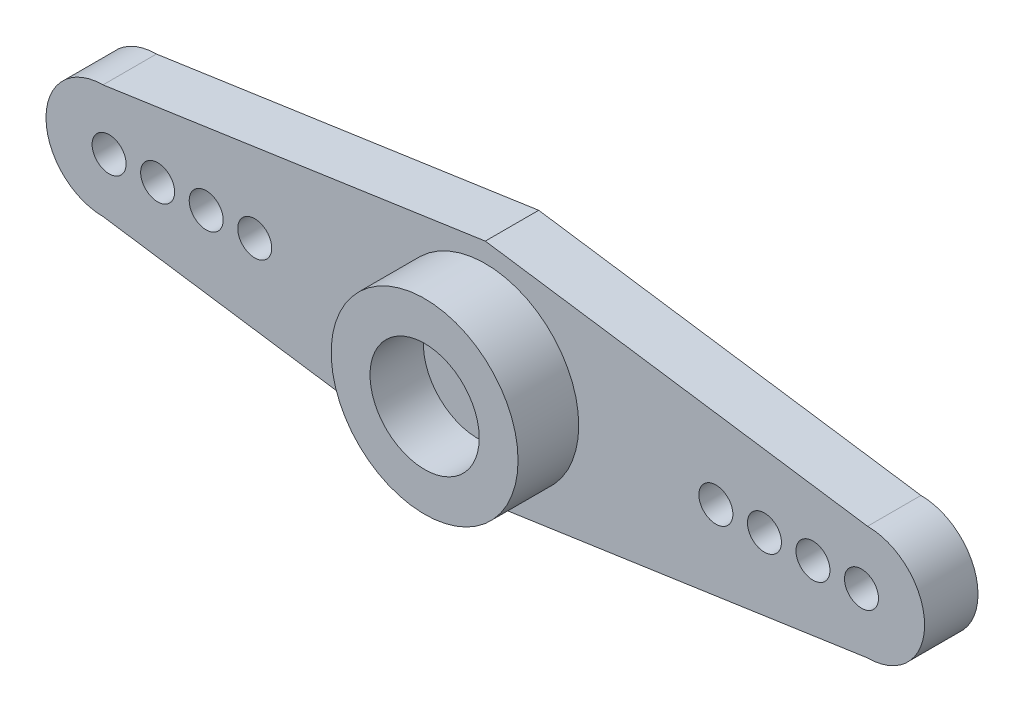
from build123d import *

# Parameters (mm, degrees)
SKETCH1_W         = 45.974
SKETCH1_H         = 11.811
EXTRUDE1_DEPTH    = 5.969
SKETCH2_OUTSIDE_W = 57.542
SKETCH2_OUTSIDE_H = 23.379
SKETCH2_OUTSIDE_R = 4.8895
EXTRUDE2_DEPTH    = 3.175
SKETCH3_R         = 2.8575
EXTRUDE3_DEPTH    = 2.794
LPATTERN1_COUNT   = 4
LPATTERN1_PITCH   = 2.54
EXTRUDE4_DEPTH    = 25.472557289


with BuildPart() as part:
    # Sketch1 → Extrude1 (new body)
    with BuildSketch(Plane.XY):
        Rectangle(SKETCH1_W, SKETCH1_H)
    extrude(amount=EXTRUDE1_DEPTH)

    # Sketch2 outside → Extrude2 (cut)
    with BuildSketch(Plane.XY.offset(5.969)):
        with Locations((0, -0.0005)):
            Rectangle(SKETCH2_OUTSIDE_W, SKETCH2_OUTSIDE_H)
        Circle(SKETCH2_OUTSIDE_R, mode=Mode.SUBTRACT)
    extrude(amount=-EXTRUDE2_DEPTH, mode=Mode.SUBTRACT)

    # Sketch3 → Extrude3 (cut)
    with BuildSketch(Plane.XY.offset(5.969)):
        Circle(SKETCH3_R)
    extrude(amount=-EXTRUDE3_DEPTH, mode=Mode.SUBTRACT)

    # Sketch5 → #50 (0.07) Diameter Hole1 (revolve, cut)
    with BuildSketch(Plane.YZ.offset(12.065)):
        Polygon((0, 0), (0, 5.61416509), (0.889, 5.08), (0.889, 0), align=None)
    f_50_0_07_diameter_hole1 = revolve(axis=Axis((12.065, 0, -6.35), (0, 0, 1)), mode=Mode.SUBTRACT)

    # LPattern1: #50 (0.07) Diameter Hole1 ×4
    with Locations(*[(i * LPATTERN1_PITCH, 0, 0) for i in range(1, LPATTERN1_COUNT)]):
        add(f_50_0_07_diameter_hole1, mode=Mode.SUBTRACT)

    # Mirror1: #50 (0.07) Diameter Hole1 across plane
    add(f_50_0_07_diameter_hole1.mirror(Plane(origin=(0, 0, 0), x_dir=(0, 0, 1), z_dir=(1, 0, 0))), mode=Mode.SUBTRACT)

    # Mirror1 copy 1 sketch → Mirror1 copy 1 (revolve, cut)
    with BuildSketch(Plane(origin=(-14.605, 0, 0), x_dir=(0, 1, 0), z_dir=(-1, 0, 0))):
        Polygon((0, 0), (0, -5.61416509), (0.889, -5.08), (0.889, 0), align=None)
    revolve(axis=Axis((-14.605, 0, -6.35), (0, 0, -1)), mode=Mode.SUBTRACT)

    # Mirror1 copy 2 sketch → Mirror1 copy 2 (revolve, cut)
    with BuildSketch(Plane(origin=(-17.145, 0, 0), x_dir=(0, 1, 0), z_dir=(-1, 0, 0))):
        Polygon((0, 0), (0, -5.61416509), (0.889, -5.08), (0.889, 0), align=None)
    revolve(axis=Axis((-17.145, 0, -6.35), (0, 0, -1)), mode=Mode.SUBTRACT)

    # Mirror1 copy 3 sketch → Mirror1 copy 3 (revolve, cut)
    with BuildSketch(Plane(origin=(-19.685, 0, 0), x_dir=(0, 1, 0), z_dir=(-1, 0, 0))):
        Polygon((0, 0), (0, -5.61416509), (0.889, -5.08), (0.889, 0), align=None)
    revolve(axis=Axis((-19.685, 0, -6.35), (0, 0, -1)), mode=Mode.SUBTRACT)

    # Sketch6 → Extrude4 (cut, through all)
    with BuildSketch(Plane(origin=(0, 0, 0), x_dir=(-1, 0, 0), z_dir=(0, 0, -1))):
        with BuildLine():
            Line((-61.04017999, 14.819304062), (0, 5.9055))
            Line((0, 5.9055), (20.0025, 2.9845))
            ThreePointArc((20.0025, 2.9845), (22.112860188, 2.110360188), (22.987, 0))
            ThreePointArc((22.987, 0), (22.112860188, -2.110360188), (20.0025, -2.9845))
            Line((20.0025, -2.9845), (0, -5.9055))
            Line((0, -5.9055), (-61.04017999, -14.819304062))
            Line((-61.04017999, -14.819304062), (62.335011618, -14.819304062))
            Line((62.335011618, -14.819304062), (62.335011618, 14.819304062))
            Line((62.335011618, 14.819304062), (-61.04017999, 14.819304062))
        make_face()
    extrude4 = extrude(amount=-EXTRUDE4_DEPTH, mode=Mode.SUBTRACT)

    # Mirror2: Extrude4 across plane
    add(extrude4.mirror(Plane(origin=(0, 0, 0), x_dir=(0, 0, 1), z_dir=(1, 0, 0))), mode=Mode.SUBTRACT)


solid = part.part
